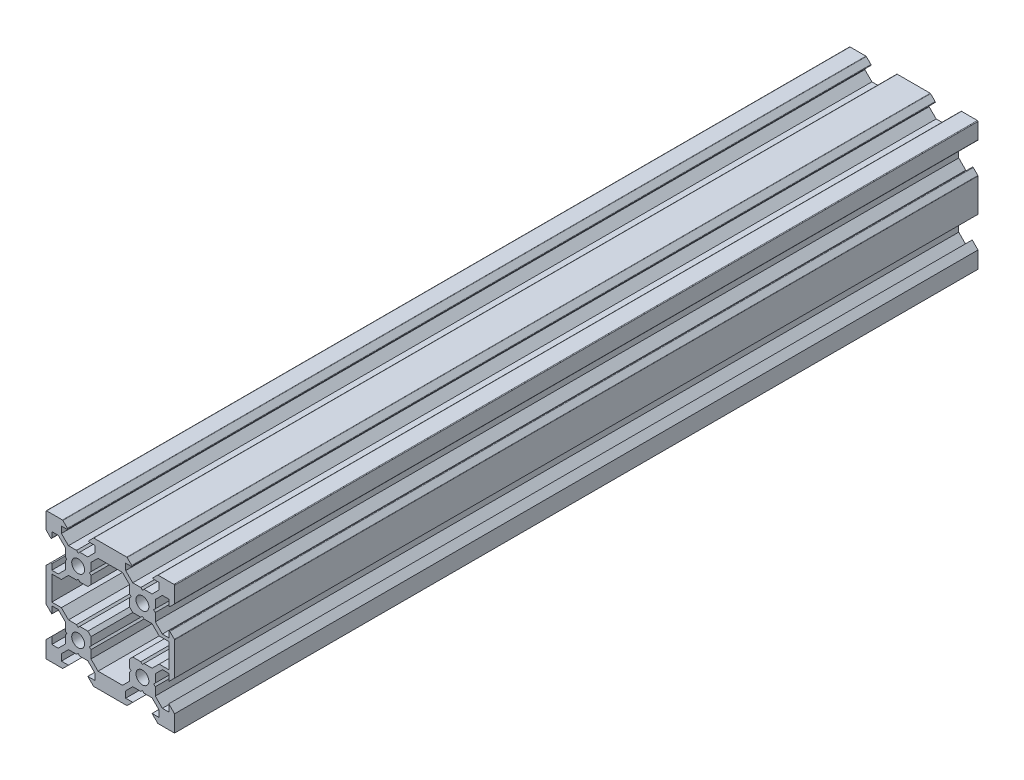
from build123d import *

# Parameters (mm, degrees)
SKETCH2_R           = 2
BOSS_EXTRUDE1_DEPTH = 250


with BuildPart() as part:
    # Sketch2 → Boss-Extrude1 (new body)
    with BuildSketch(Plane.XY):
        with BuildLine():
            Line((-5.00990601, -16.077415508), (-5.00990601, -18.077415508))
            Line((-5.00990601, -18.077415508), (-7.219956517, -18.077415508))
            Line((-7.219956517, -18.077415508), (-5.419956517, -19.877415508))
            Line((-5.419956517, -19.877415508), (4.980043483, -19.877415508))
            Line((4.980043483, -19.877415508), (6.780043483, -18.077415508))
            Line((6.780043483, -18.077415508), (4.569992977, -18.077415508))
            Line((4.569992977, -18.077415508), (4.569992977, -16.077415508))
            Line((4.569992977, -16.077415508), (6.769992977, -13.877415508))
            Line((6.769992977, -13.877415508), (9.280043483, -13.877415508))
            Line((9.280043483, -13.877415508), (9.780043483, -13.377415508))
            Line((9.780043483, -13.377415508), (10.280043483, -13.877415508))
            Line((10.280043483, -13.877415508), (12.79009399, -13.877415508))
            Line((12.79009399, -13.877415508), (14.99009399, -16.077415508))
            Line((14.99009399, -16.077415508), (14.99009399, -18.077415508))
            Line((14.99009399, -18.077415508), (12.780043483, -18.077415508))
            Line((12.780043483, -18.077415508), (14.580043483, -19.877415508))
            Line((14.580043483, -19.877415508), (19.780043483, -19.877415508))
            Line((19.780043483, -19.877415508), (19.780043483, -14.677415508))
            Line((19.780043483, -14.677415508), (17.980043483, -12.877415508))
            Line((17.980043483, -12.877415508), (17.980043483, -15.087466015))
            Line((17.980043483, -15.087466015), (15.980043483, -15.087466015))
            Line((15.980043483, -15.087466015), (13.780043483, -12.887466015))
            Line((13.780043483, -12.887466015), (13.780043483, -10.377415508))
            Line((13.780043483, -10.377415508), (13.280043483, -9.877415508))
            Line((13.280043483, -9.877415508), (13.780043483, -9.377415508))
            Line((13.780043483, -9.377415508), (13.780043483, -6.867365002))
            Line((13.780043483, -6.867365002), (15.980043483, -4.667365002))
            Line((15.980043483, -4.667365002), (17.980043483, -4.667365002))
            Line((17.980043483, -4.667365002), (17.980043483, -6.877415508))
            Line((17.980043483, -6.877415508), (19.780043483, -5.077415508))
            Line((19.780043483, -5.077415508), (19.780043483, 5.239741779))
            ThreePointArc((19.780043483, 5.239741779), (19.76481939, 5.316278466), (19.72146484, 5.381163136))
            Line((19.72146484, 5.381163136), (18.32146484, 6.781163136))
            ThreePointArc((18.32146484, 6.781163136), (18.103506797, 6.824517686), (17.980043483, 6.639741779))
            Line((17.980043483, 6.639741779), (17.980043483, 4.912533985))
            Line((17.980043483, 4.912533985), (15.980043483, 4.912533985))
            Line((15.980043483, 4.912533985), (13.780043483, 7.112533985))
            Line((13.780043483, 7.112533985), (13.780043483, 9.622584492))
            Line((13.780043483, 9.622584492), (13.280043483, 10.122584492))
            Line((13.280043483, 10.122584492), (13.780043483, 10.622584492))
            Line((13.780043483, 10.622584492), (13.780043483, 13.132634998))
            Line((13.780043483, 13.132634998), (15.980043483, 15.332634998))
            Line((15.980043483, 15.332634998), (17.980043483, 15.332634998))
            Line((17.980043483, 15.332634998), (17.980043483, 13.605427204))
            ThreePointArc((17.980043483, 13.605427204), (18.103506797, 13.420651298), (18.32146484, 13.464005848))
            Line((18.32146484, 13.464005848), (19.72146484, 14.864005848))
            ThreePointArc((19.72146484, 14.864005848), (19.76481939, 14.928890518), (19.780043483, 15.005427204))
            Line((19.780043483, 15.005427204), (19.780043483, 19.922584492))
            ThreePointArc((19.780043483, 19.922584492), (19.72146484, 20.064005848), (19.580043483, 20.122584492))
            Line((19.580043483, 20.122584492), (14.662886196, 20.122584492))
            ThreePointArc((14.662886196, 20.122584492), (14.586349509, 20.107360398), (14.52146484, 20.064005848))
            Line((14.52146484, 20.064005848), (13.12146484, 18.664005848))
            ThreePointArc((13.12146484, 18.664005848), (13.078110289, 18.446047805), (13.262886196, 18.322584492))
            Line((13.262886196, 18.322584492), (14.99009399, 18.322584492))
            Line((14.99009399, 18.322584492), (14.99009399, 16.322584492))
            Line((14.99009399, 16.322584492), (12.79009399, 14.122584492))
            Line((12.79009399, 14.122584492), (10.280043483, 14.122584492))
            Line((10.280043483, 14.122584492), (9.780043483, 13.622584492))
            Line((9.780043483, 13.622584492), (9.280043483, 14.122584492))
            Line((9.280043483, 14.122584492), (6.769992977, 14.122584492))
            Line((6.769992977, 14.122584492), (4.569992977, 16.322584492))
            Line((4.569992977, 16.322584492), (4.569992977, 18.322584492))
            Line((4.569992977, 18.322584492), (6.297200771, 18.322584492))
            ThreePointArc((6.297200771, 18.322584492), (6.481976677, 18.446047805), (6.438622127, 18.664005848))
            Line((6.438622127, 18.664005848), (5.038622127, 20.064005848))
            ThreePointArc((5.038622127, 20.064005848), (4.973737457, 20.107360398), (4.897200771, 20.122584492))
            Line((4.897200771, 20.122584492), (-5.337113804, 20.122584492))
            ThreePointArc((-5.337113804, 20.122584492), (-5.413650491, 20.107360398), (-5.47853516, 20.064005848))
            Line((-5.47853516, 20.064005848), (-6.87853516, 18.664005848))
            ThreePointArc((-6.87853516, 18.664005848), (-6.921889711, 18.446047805), (-6.737113804, 18.322584492))
            Line((-6.737113804, 18.322584492), (-5.00990601, 18.322584492))
            Line((-5.00990601, 18.322584492), (-5.00990601, 16.322584492))
            Line((-5.00990601, 16.322584492), (-7.20990601, 14.122584492))
            Line((-7.20990601, 14.122584492), (-9.719956517, 14.122584492))
            Line((-9.719956517, 14.122584492), (-10.219956517, 13.622584492))
            Line((-10.219956517, 13.622584492), (-10.719956517, 14.122584492))
            Line((-10.719956517, 14.122584492), (-13.230007023, 14.122584492))
            Line((-13.230007023, 14.122584492), (-15.430007023, 16.322584492))
            Line((-15.430007023, 16.322584492), (-15.430007023, 18.322584492))
            Line((-15.430007023, 18.322584492), (-13.702799229, 18.322584492))
            ThreePointArc((-13.702799229, 18.322584492), (-13.518023323, 18.446047805), (-13.561377873, 18.664005848))
            Line((-13.561377873, 18.664005848), (-14.961377873, 20.064005848))
            ThreePointArc((-14.961377873, 20.064005848), (-15.026262543, 20.107360398), (-15.102799229, 20.122584492))
            Line((-15.102799229, 20.122584492), (-20.019956517, 20.122584492))
            ThreePointArc((-20.019956517, 20.122584492), (-20.161377873, 20.064005848), (-20.219956517, 19.922584492))
            Line((-20.219956517, 19.922584492), (-20.219956517, 15.005427204))
            ThreePointArc((-20.219956517, 15.005427204), (-20.204732423, 14.928890518), (-20.161377873, 14.864005848))
            Line((-20.161377873, 14.864005848), (-18.761377873, 13.464005848))
            ThreePointArc((-18.761377873, 13.464005848), (-18.54341983, 13.420651298), (-18.419956517, 13.605427204))
            Line((-18.419956517, 13.605427204), (-18.419956517, 15.332634998))
            Line((-18.419956517, 15.332634998), (-16.419956517, 15.332634998))
            Line((-16.419956517, 15.332634998), (-14.219956517, 13.132634998))
            Line((-14.219956517, 13.132634998), (-14.219956517, 10.622584492))
            Line((-14.219956517, 10.622584492), (-13.719956517, 10.122584492))
            Line((-13.719956517, 10.122584492), (-14.219956517, 9.622584492))
            Line((-14.219956517, 9.622584492), (-14.219956517, 7.112533985))
            Line((-14.219956517, 7.112533985), (-16.419956517, 4.912533985))
            Line((-16.419956517, 4.912533985), (-18.419956517, 4.912533985))
            Line((-18.419956517, 4.912533985), (-18.419956517, 6.639741779))
            ThreePointArc((-18.419956517, 6.639741779), (-18.54341983, 6.824517686), (-18.761377873, 6.781163136))
            Line((-18.761377873, 6.781163136), (-20.161377873, 5.381163136))
            ThreePointArc((-20.161377873, 5.381163136), (-20.204732423, 5.316278466), (-20.219956517, 5.239741779))
            Line((-20.219956517, 5.239741779), (-20.219956517, -5.077415508))
            Line((-20.219956517, -5.077415508), (-18.419956517, -6.877415508))
            Line((-18.419956517, -6.877415508), (-18.419956517, -4.667365002))
            Line((-18.419956517, -4.667365002), (-16.419956517, -4.667365002))
            Line((-16.419956517, -4.667365002), (-14.219956517, -6.867365002))
            Line((-14.219956517, -6.867365002), (-14.219956517, -9.377415508))
            Line((-14.219956517, -9.377415508), (-13.719956517, -9.877415508))
            Line((-13.719956517, -9.877415508), (-14.219956517, -10.377415508))
            Line((-14.219956517, -10.377415508), (-14.219956517, -12.887466015))
            Line((-14.219956517, -12.887466015), (-16.419956517, -15.087466015))
            Line((-16.419956517, -15.087466015), (-18.419956517, -15.087466015))
            Line((-18.419956517, -15.087466015), (-18.419956517, -12.877415508))
            Line((-18.419956517, -12.877415508), (-20.219956517, -14.677415508))
            Line((-20.219956517, -14.677415508), (-20.219956517, -19.877415508))
            Line((-20.219956517, -19.877415508), (-15.019956517, -19.877415508))
            Line((-15.019956517, -19.877415508), (-13.219956517, -18.077415508))
            Line((-13.219956517, -18.077415508), (-15.430007023, -18.077415508))
            Line((-15.430007023, -18.077415508), (-15.430007023, -16.077415508))
            Line((-15.430007023, -16.077415508), (-13.230007023, -13.877415508))
            Line((-13.230007023, -13.877415508), (-10.719956517, -13.877415508))
            Line((-10.719956517, -13.877415508), (-10.219956517, -13.377415508))
            Line((-10.219956517, -13.377415508), (-9.719956517, -13.877415508))
            Line((-9.719956517, -13.877415508), (-7.20990601, -13.877415508))
            Line((-7.20990601, -13.877415508), (-5.00990601, -16.077415508))
        make_face()
        with Locations((-10.219956517, 10.122584492)):
            Circle(SKETCH2_R, mode=Mode.SUBTRACT)
        with Locations((9.780043483, 10.122584492)):
            Circle(SKETCH2_R, mode=Mode.SUBTRACT)
        with Locations((-10.219956517, -9.877415508)):
            Circle(SKETCH2_R, mode=Mode.SUBTRACT)
        with Locations((9.780043483, -9.877415508)):
            Circle(SKETCH2_R, mode=Mode.SUBTRACT)
        Polygon((-6.219956517, 13.132634998), (-4.019956517, 15.332634998), (3.580043483, 15.332634998), (5.780043483, 13.132634998), (5.780043483, 10.622584492), (6.280043483, 10.122584492), (5.780043483, 9.622584492), (5.780043483, 7.112533985), (6.769992977, 6.122584492), (9.280043483, 6.122584492), (9.780043483, 6.622584492), (10.280043483, 6.122584492), (12.79009399, 6.122584492), (14.99009399, 3.922584492), (17.980043483, 3.922584492), (17.980043483, -3.677415508), (14.99009399, -3.677415508), (12.79009399, -5.877415508), (10.280043483, -5.877415508), (9.780043483, -6.377415508), (9.280043483, -5.877415508), (6.769992977, -5.877415508), (5.780043483, -6.867365002), (5.780043483, -9.377415508), (6.280043483, -9.877415508), (5.780043483, -10.377415508), (5.780043483, -12.887466015), (3.580043483, -15.087466015), (-4.019956517, -15.087466015), (-6.219956517, -12.887466015), (-6.219956517, -10.377415508), (-6.719956517, -9.877415508), (-6.219956517, -9.377415508), (-6.219956517, -6.867365002), (-7.20990601, -5.877415508), (-9.719956517, -5.877415508), (-10.219956517, -6.377415508), (-10.719956517, -5.877415508), (-13.230007023, -5.877415508), (-15.430007023, -3.677415508), (-18.419956517, -3.677415508), (-18.419956517, 3.922584492), (-15.430007023, 3.922584492), (-13.230007023, 6.122584492), (-10.719956517, 6.122584492), (-10.219956517, 6.622584492), (-9.719956517, 6.122584492), (-7.20990601, 6.122584492), (-6.219956517, 7.112533985), (-6.219956517, 9.622584492), (-6.719956517, 10.122584492), (-6.219956517, 10.622584492), align=None, mode=Mode.SUBTRACT)
    extrude(amount=-BOSS_EXTRUDE1_DEPTH)


solid = part.part
